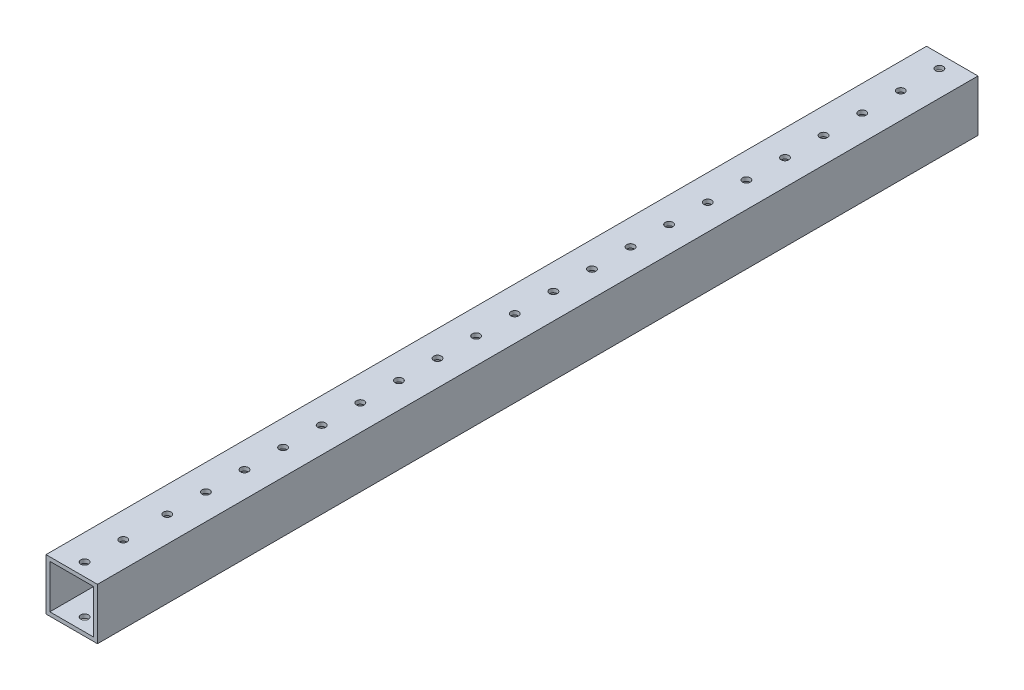
from build123d import *

# Parameters (mm, degrees)
SKETCH_1_W          = 20
SKETCH_1_H          = 20
SKETCH_1_W_2        = 17
SKETCH_1_H_2        = 17
EXTRUDE_1_DEPTH     = 342.12
SKETCH_2_R          = 1.5
CUT_EXTRUDE_1_DEPTH = 343.84995902
SKETCH_3_R          = 1.5
CUT_EXTRUDE_2_DEPTH = 343.84995902


with BuildPart() as part:
    # 草图1 → 凸台-拉伸1 (new body)
    with BuildSketch(Plane.XY):
        Rectangle(SKETCH_1_W, SKETCH_1_H)
        Rectangle(SKETCH_1_W_2, SKETCH_1_H_2, mode=Mode.SUBTRACT)
    extrude(amount=EXTRUDE_1_DEPTH)

    # 草图2 → 切除-拉伸1 (cut, through all)
    with BuildSketch(Plane(origin=(0, 10, 0), x_dir=(1, 0, 0), z_dir=(0, 1, 0))):
        with Locations(Location((0, -5, 0), (0, 0, 270))):
            Circle(SKETCH_2_R)
        with Locations(Location((0, -20, 0), (0, 0, 270))):
            Circle(SKETCH_2_R)
        with Locations(Location((0, -337.12, 0), (0, 0, 270))):
            Circle(SKETCH_2_R)
        with Locations(Location((0, -322.12, 0), (0, 0, 270))):
            Circle(SKETCH_2_R)
    extrude(amount=-CUT_EXTRUDE_1_DEPTH, mode=Mode.SUBTRACT)

    # 草图3 → 切除-拉伸2 (cut, through all)
    with BuildSketch(Plane(origin=(0, 10, 0), x_dir=(1, 0, 0), z_dir=(0, 1, 0))):
        with Locations(Location((0, -35, 0), (0, 0, 270))):
            Circle(SKETCH_3_R)
        with Locations(Location((0, -50, 0), (0, 0, 270))):
            Circle(SKETCH_3_R)
        with Locations(Location((0, -65, 0), (0, 0, 270))):
            Circle(SKETCH_3_R)
        with Locations(Location((0, -80, 0), (0, 0, 270))):
            Circle(SKETCH_3_R)
        with Locations(Location((0, -95, 0), (0, 0, 270))):
            Circle(SKETCH_3_R)
        with Locations(Location((0, -110, 0), (0, 0, 270))):
            Circle(SKETCH_3_R)
        with Locations(Location((0, -125, 0), (0, 0, 270))):
            Circle(SKETCH_3_R)
        with Locations(Location((0, -140, 0), (0, 0, 270))):
            Circle(SKETCH_3_R)
        with Locations(Location((0, -155, 0), (0, 0, 270))):
            Circle(SKETCH_3_R)
        with Locations(Location((0, -170, 0), (0, 0, 270))):
            Circle(SKETCH_3_R)
        with Locations(Location((0, -185, 0), (0, 0, 270))):
            Circle(SKETCH_3_R)
        with Locations(Location((0, -200, 0), (0, 0, 270))):
            Circle(SKETCH_3_R)
        with Locations(Location((0, -215, 0), (0, 0, 270))):
            Circle(SKETCH_3_R)
        with Locations(Location((0, -230, 0), (0, 0, 270))):
            Circle(SKETCH_3_R)
        with Locations(Location((0, -245, 0), (0, 0, 270))):
            Circle(SKETCH_3_R)
        with Locations(Location((0, -260, 0), (0, 0, 270))):
            Circle(SKETCH_3_R)
        with Locations(Location((0, -275, 0), (0, 0, 270))):
            Circle(SKETCH_3_R)
        with Locations(Location((0, -290, 0), (0, 0, 270))):
            Circle(SKETCH_3_R)
        with Locations(Location((0, -305, 0), (0, 0, 270))):
            Circle(SKETCH_3_R)
    extrude(amount=-CUT_EXTRUDE_2_DEPTH, mode=Mode.SUBTRACT)


solid = part.part
